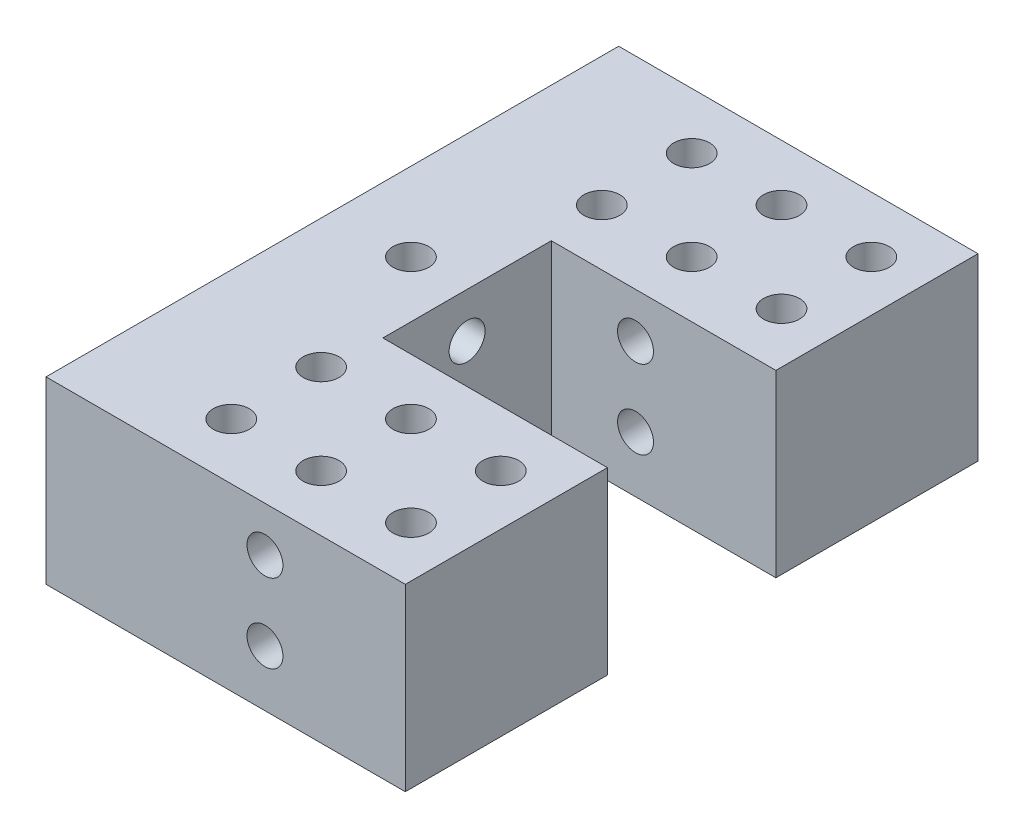
from build123d import *

# Parameters (mm, degrees)
SKETCH_1_R          = 1.6
EXTRUDE_1_DEPTH     = 16
CUT_EXTRUDE_1_REACH = 64.298
SKETCH_2_R          = 1.6
CUT_EXTRUDE_2_REACH = 64.298
SKETCH_3_R          = 1.6


with BuildPart() as part:
    # 草图1 → 凸台-拉伸1 (new body)
    with BuildSketch(Plane(origin=(0, 0, 0), x_dir=(1, 0, 0), z_dir=(0, 1, 0))):
        Polygon((0, 0), (32, 0), (32, -18), (12, -18), (12, -33), (32, -33), (32, -51), (0, -51), align=None)
        with Locations(Location((19.5, -13, 0), (0, 0, 270))):
            Circle(SKETCH_1_R, mode=Mode.SUBTRACT)
        with Locations(Location((19.5, -5, 0), (0, 0, 270))):
            Circle(SKETCH_1_R, mode=Mode.SUBTRACT)
        with Locations(Location((27.5, -5, 0), (0, 0, 270))):
            Circle(SKETCH_1_R, mode=Mode.SUBTRACT)
        with Locations(Location((27.5, -13, 0), (0, 0, 270))):
            Circle(SKETCH_1_R, mode=Mode.SUBTRACT)
        with Locations(Location((11.5, -5, 0), (0, 0, 270))):
            Circle(SKETCH_1_R, mode=Mode.SUBTRACT)
        with Locations(Location((11.5, -13, 0), (0, 0, 270))):
            Circle(SKETCH_1_R, mode=Mode.SUBTRACT)
        with Locations(Location((27.5, -38, 0), (0, 0, 90))):
            Circle(SKETCH_1_R, mode=Mode.SUBTRACT)
        with Locations(Location((19.5, -38, 0), (0, 0, 90))):
            Circle(SKETCH_1_R, mode=Mode.SUBTRACT)
        with Locations(Location((11.5, -38, 0), (0, 0, 90))):
            Circle(SKETCH_1_R, mode=Mode.SUBTRACT)
        with Locations(Location((27.5, -46, 0), (0, 0, 90))):
            Circle(SKETCH_1_R, mode=Mode.SUBTRACT)
        with Locations(Location((19.5, -46, 0), (0, 0, 90))):
            Circle(SKETCH_1_R, mode=Mode.SUBTRACT)
        with Locations(Location((11.5, -46, 0), (0, 0, 90))):
            Circle(SKETCH_1_R, mode=Mode.SUBTRACT)
        with Locations(Location((7, -25.5, 0), (0, 0, 270))):
            Circle(SKETCH_1_R, mode=Mode.SUBTRACT)
    extrude(amount=EXTRUDE_1_DEPTH)

    # 切除-拉伸1: up to this face of the body (flat: up to its plane)
    cut_extrude_1_end = Plane(part.part.faces().sort_by_distance((16, 8, 0))[0])
    # 草图2 → 切除-拉伸1 (cut, up to the picked face)
    with BuildSketch(Plane.XY.offset(51), mode=Mode.PRIVATE) as cut_extrude_1_sk1:
        with Locations((19.5, 12)):
            Circle(SKETCH_2_R)
    cut_extrude_1_tool1 = split(extrude(cut_extrude_1_sk1.sketch, amount=-CUT_EXTRUDE_1_REACH, mode=Mode.PRIVATE), bisect_by=cut_extrude_1_end, keep=Keep.BOTH, mode=Mode.PRIVATE)
    # 草图2 → 切除-拉伸1 (cut, up to the picked face)
    with BuildSketch(Plane.XY.offset(51), mode=Mode.PRIVATE) as cut_extrude_1_sk2:
        with Locations((19.5, 5)):
            Circle(SKETCH_2_R)
    cut_extrude_1_tool2 = split(extrude(cut_extrude_1_sk2.sketch, amount=-CUT_EXTRUDE_1_REACH, mode=Mode.PRIVATE), bisect_by=cut_extrude_1_end, keep=Keep.BOTH, mode=Mode.PRIVATE)
    add(cut_extrude_1_tool1.solids().sort_by(Axis((19.5, 12, 51), (0, 0, -1)))[0], mode=Mode.SUBTRACT)
    add(cut_extrude_1_tool2.solids().sort_by(Axis((19.5, 5, 51), (0, 0, -1)))[0], mode=Mode.SUBTRACT)

    # 切除-拉伸2: up to this face of the body (flat: up to its plane)
    cut_extrude_2_end = Plane(part.part.faces().sort_by_distance((12, 8, 25.5))[0])
    # 草图3 → 切除-拉伸2 (cut, up to the picked face)
    with BuildSketch(Plane.ZY, mode=Mode.PRIVATE) as cut_extrude_2_sk1:
        with Locations((25.5, 5)):
            Circle(SKETCH_3_R)
    cut_extrude_2_tool1 = split(extrude(cut_extrude_2_sk1.sketch, amount=-CUT_EXTRUDE_2_REACH, mode=Mode.PRIVATE), bisect_by=cut_extrude_2_end, keep=Keep.BOTH, mode=Mode.PRIVATE)
    # 草图3 → 切除-拉伸2 (cut, up to the picked face)
    with BuildSketch(Plane.ZY, mode=Mode.PRIVATE) as cut_extrude_2_sk2:
        with Locations((25.5, 12)):
            Circle(SKETCH_3_R)
    cut_extrude_2_tool2 = split(extrude(cut_extrude_2_sk2.sketch, amount=-CUT_EXTRUDE_2_REACH, mode=Mode.PRIVATE), bisect_by=cut_extrude_2_end, keep=Keep.BOTH, mode=Mode.PRIVATE)
    add(cut_extrude_2_tool1.solids().sort_by(Axis((0, 5, 25.5), (1, 0, 0)))[0], mode=Mode.SUBTRACT)
    add(cut_extrude_2_tool2.solids().sort_by(Axis((0, 12, 25.5), (1, 0, 0)))[0], mode=Mode.SUBTRACT)


solid = part.part
